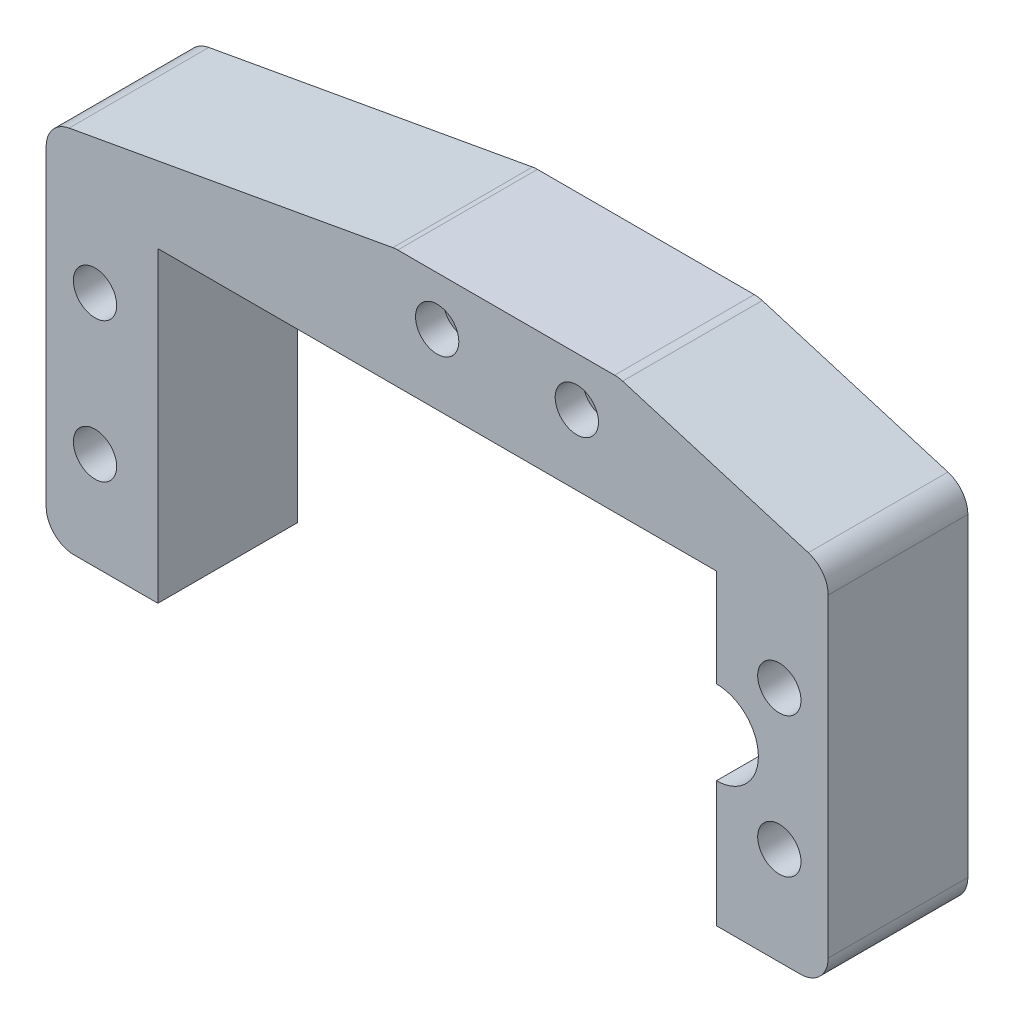
from build123d import *

# Parameters (mm, degrees)
SKETCH_1_R      = 1.55
EXTRUDE_3_DEPTH = 2
EXTRUDE_START   = -8
SKETCH_1_7_R    = 1.55
EXTRUDE_5_DEPTH = 8
FILLET_4_R      = 2


with BuildPart() as part:
    # 草图1 → 凸台-拉伸3 (new body)
    with BuildSketch(Plane.XY):
        with BuildLine():
            ThreePointArc((20, 3), (23, 0), (20, -3))
            Line((20, -3), (20, -12))
            Line((20, -12), (28, -12))
            Line((28, -12), (28, 14))
            Line((28, 14), (13, 18.5))
            Line((13, 18.5), (-3, 18.5))
            Line((-3, 18.5), (-28, 14))
            Line((-28, 14), (-28, -12))
            Line((-28, -12), (-20, -12))
            Line((-20, -12), (-20, 10))
            Line((-20, 10), (20, 10))
            Line((20, 10), (20, 3))
        make_face()
        with Locations((24.5, 5)):
            Circle(SKETCH_1_R, mode=Mode.SUBTRACT)
        with Locations((24.5, -5)):
            Circle(SKETCH_1_R, mode=Mode.SUBTRACT)
        with Locations((-24.5, 5)):
            Circle(SKETCH_1_R, mode=Mode.SUBTRACT)
        with Locations((-24.5, -5)):
            Circle(SKETCH_1_R, mode=Mode.SUBTRACT)
        with Locations((0, 15)):
            Circle(SKETCH_1_R, mode=Mode.SUBTRACT)
        with Locations((10, 15)):
            Circle(SKETCH_1_R, mode=Mode.SUBTRACT)
    extrude(amount=EXTRUDE_3_DEPTH)

    # 草图1<7> → 凸台-拉伸5 (add)
    with BuildSketch(Plane.XY.offset(EXTRUDE_START)):
        with BuildLine():
            ThreePointArc((20, 3), (23, 0), (20, -3))
            Line((20, -3), (20, -12))
            Line((20, -12), (28, -12))
            Line((28, -12), (28, 14))
            Line((28, 14), (13, 18.5))
            Line((13, 18.5), (-3, 18.5))
            Line((-3, 18.5), (-28, 14))
            Line((-28, 14), (-28, -12))
            Line((-28, -12), (-20, -12))
            Line((-20, -12), (-20, 10))
            Line((-20, 10), (20, 10))
            Line((20, 10), (20, 3))
        make_face()
        with Locations((24.5, 5)):
            Circle(SKETCH_1_7_R, mode=Mode.SUBTRACT)
        with Locations((24.5, -5)):
            Circle(SKETCH_1_7_R, mode=Mode.SUBTRACT)
        with Locations((-24.5, 5)):
            Circle(SKETCH_1_7_R, mode=Mode.SUBTRACT)
        with Locations((-24.5, -5)):
            Circle(SKETCH_1_7_R, mode=Mode.SUBTRACT)
        Polygon((-1.356773133, 12.65), (-2.713546265, 15), (-1.356773133, 17.35), (1.356773133, 17.35), (2.713546265, 15), (1.356773133, 12.65), align=None, mode=Mode.SUBTRACT)
        Polygon((8.643226867, 12.65), (7.286453735, 15), (8.643226867, 17.35), (11.356773133, 17.35), (12.713546265, 15), (11.356773133, 12.65), align=None, mode=Mode.SUBTRACT)
    extrude(amount=EXTRUDE_5_DEPTH)

    # 圆角4
    fillet_4_edges = [part.edges().sort_by_distance(p)[0] for p in [
        (28, -12, -3),
        (-28, -12, -3),
        (-28, 14, -3),
        (-3, 18.5, -3),
        (13, 18.5, -3),
        (28, 14, -3),
    ]]
    fillet(fillet_4_edges, radius=FILLET_4_R)


solid = part.part
